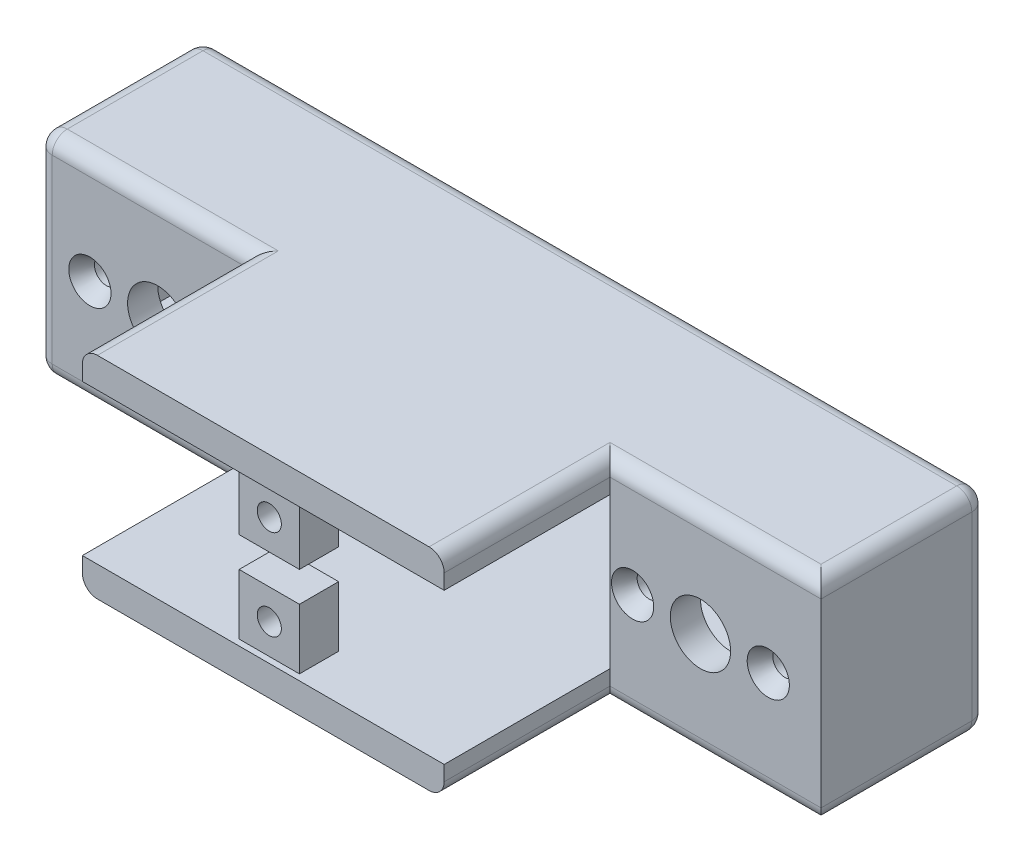
from build123d import *

# Parameters (mm, degrees)
SKETCH_1_W          = 52
SKETCH_1_H          = 14
EXTRUDE_1_DEPTH     = 11
SHELL_1_T           = -2
SKETCH_2_W          = 24
SKETCH_2_H          = 10
CUT_EXTRUDE_1_DEPTH = 2
SKETCH_3_W          = 24
SKETCH_3_H          = 2
EXTRUDE_2_DEPTH     = 11
SKETCH_8_R          = 2
CUT_EXTRUDE_5_DEPTH = 2
FILLET_1_R          = 1
SKETCH_15_W         = 4
SKETCH_15_H         = 4
EXTRUDE_4_DEPTH     = 3
SKETCH_16_R         = 0.8
CUT_EXTRUDE_7_DEPTH = 3
SKETCH_17_W         = 24
SKETCH_17_H         = 10
CUT_EXTRUDE_8_DEPTH = 0.4


with BuildPart() as part:
    # 草图1 → 凸台-拉伸1 (new body)
    with BuildSketch(Plane.XY):
        with Locations((26, 7)):
            Rectangle(SKETCH_1_W, SKETCH_1_H)
    extrude(amount=EXTRUDE_1_DEPTH)

    # 抽壳1
    shell_1_openings = [part.faces().sort_by_distance(p)[0] for p in [
        (26, 7, 0),
    ]]
    offset(amount=SHELL_1_T, openings=shell_1_openings, kind=Kind.INTERSECTION)

    # 草图2 → 切除-拉伸1 (cut)
    with BuildSketch(Plane(origin=(0, 0, 9), x_dir=(-1, 0, 0), z_dir=(0, 0, -1))):
        with Locations((-26, 7)):
            Rectangle(SKETCH_2_W, SKETCH_2_H)
    extrude(amount=-CUT_EXTRUDE_1_DEPTH, mode=Mode.SUBTRACT)

    # 草图3 → 凸台-拉伸2 (add)
    with BuildSketch(Plane.XY.offset(11)):
        with Locations((26, 1)):
            Rectangle(SKETCH_3_W, SKETCH_3_H)
        with Locations((26, 13)):
            Rectangle(SKETCH_3_W, SKETCH_3_H)
    extrude(amount=EXTRUDE_2_DEPTH)

    # 草图8 → 切除-拉伸5 (cut)
    with BuildSketch(Plane.XY.offset(11)):
        with Locations((8, 7)):
            Circle(SKETCH_8_R)
        with Locations((44, 7)):
            Circle(SKETCH_8_R)
    extrude(amount=-CUT_EXTRUDE_5_DEPTH, mode=Mode.SUBTRACT)

    # 圆角1
    fillet_1_edges = [part.edges().sort_by_distance(p)[0] for p in [
        (45, 14, 11),
        (45, 0, 11),
        (7, 14, 11),
        (38, 0, 16.5),
        (14, 0, 16.5),
        (0, 7, 11),
        (26, 14, 0),
        (14, 14, 16.5),
        (38, 14, 16.5),
        (52, 7, 0),
        (26, 0, 0),
        (0, 7, 0),
        (0, 14, 5.5),
        (52, 14, 5.5),
        (52, 0, 5.5),
        (0, 0, 5.5),
        (7, 0, 11),
    ]]
    fillet(fillet_1_edges, radius=FILLET_1_R)

    # 草图15 → 凸台-拉伸4 (add)
    with BuildSketch(Plane.XY.offset(22)):
        with Locations((26, 4)):
            Rectangle(SKETCH_15_W, SKETCH_15_H)
        with Locations((26, 10)):
            Rectangle(SKETCH_15_W, SKETCH_15_H)
    extrude(amount=-EXTRUDE_4_DEPTH)

    # 草图16 → 切除-拉伸7 (cut)
    with BuildSketch(Plane.XY.offset(22)):
        with Locations((26, 10)):
            Circle(SKETCH_16_R)
        with Locations((26, 4)):
            Circle(SKETCH_16_R)
    extrude(amount=-CUT_EXTRUDE_7_DEPTH, mode=Mode.SUBTRACT)

    # 草图19 → 切除-旋转6 (revolve, cut)
    with BuildSketch(Plane(origin=(0, 7, 0), x_dir=(1, 0, 0), z_dir=(0, 1, 0)), mode=Mode.PRIVATE) as cut_revolve_6_sk:
        Polygon((2.1, -11), (3.5, -11), (3.5, -9), (2.7, -9), (2.7, -9.9), align=None)
    revolve(cut_revolve_6_sk.sketch.rotate(Axis((3.5, 7, 11), (0, 0, -1)), 270), axis=Axis((3.5, 7, 11), (0, 0, -1)), mode=Mode.SUBTRACT)

    # 草图20 → 切除-旋转7 (revolve, cut)
    with BuildSketch(Plane(origin=(0, 7, 0), x_dir=(1, 0, 0), z_dir=(0, 1, 0)), mode=Mode.PRIVATE) as cut_revolve_7_sk:
        Polygon((11.1, -11), (12.5, -11), (12.5, -9), (11.7, -9), (11.7, -9.9), align=None)
    revolve(cut_revolve_7_sk.sketch.rotate(Axis((12.5, 7, 11), (0, 0, -1)), 270), axis=Axis((12.5, 7, 11), (0, 0, -1)), mode=Mode.SUBTRACT)

    # 草图21 → 切除-旋转8 (revolve, cut)
    with BuildSketch(Plane(origin=(0, 7, 0), x_dir=(1, 0, 0), z_dir=(0, 1, 0)), mode=Mode.PRIVATE) as cut_revolve_8_sk:
        Polygon((38.1, -11), (39.5, -11), (39.5, -9), (38.7, -9), (38.7, -9.9), align=None)
    revolve(cut_revolve_8_sk.sketch.rotate(Axis((39.5, 7, 11), (0, 0, -1)), 270), axis=Axis((39.5, 7, 11), (0, 0, -1)), mode=Mode.SUBTRACT)

    # 草图22 → 切除-旋转9 (revolve, cut)
    with BuildSketch(Plane(origin=(0, 7, 0), x_dir=(1, 0, 0), z_dir=(0, 1, 0)), mode=Mode.PRIVATE) as cut_revolve_9_sk:
        Polygon((47.1, -11), (48.5, -11), (48.5, -9), (47.7, -9), (47.7, -9.9), align=None)
    revolve(cut_revolve_9_sk.sketch.rotate(Axis((48.5, 7, 11), (0, 0, -1)), 270), axis=Axis((48.5, 7, 11), (0, 0, -1)), mode=Mode.SUBTRACT)

    # 草图17 → 切除-拉伸8 (cut)
    with BuildSketch(Plane.XY.offset(22)):
        with Locations((26, 7)):
            Rectangle(SKETCH_17_W, SKETCH_17_H)
    extrude(amount=-CUT_EXTRUDE_8_DEPTH, mode=Mode.SUBTRACT)


solid = part.part
